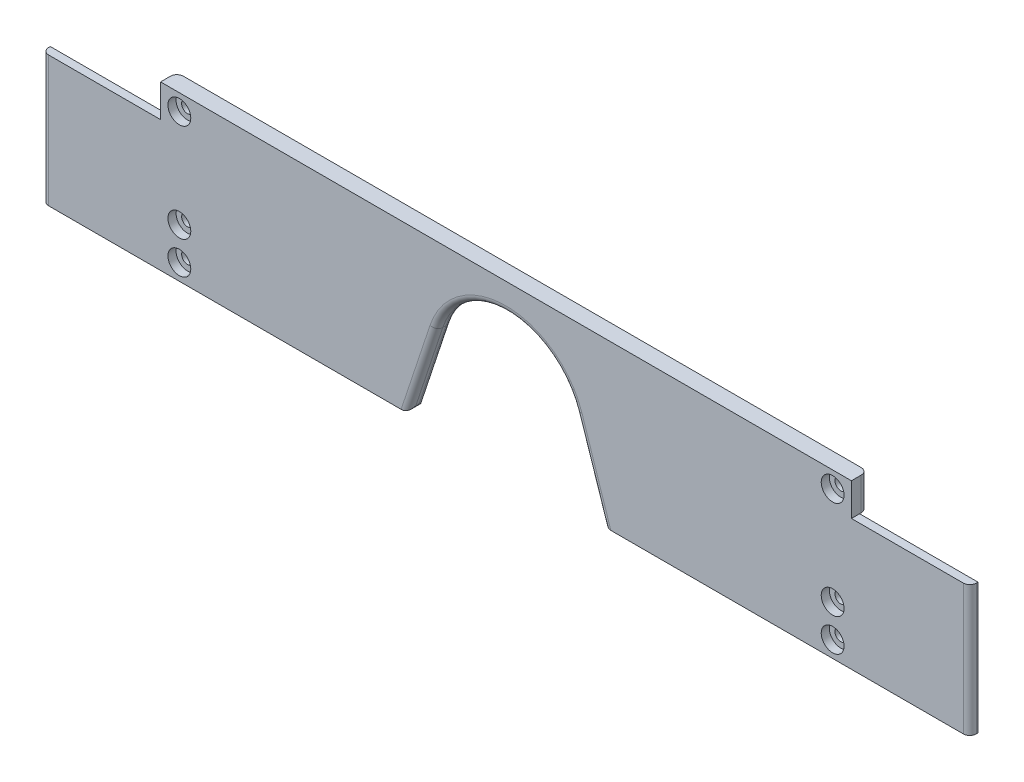
from build123d import *

# Parameters (mm, degrees)
SKETCH1_W           = 268.605
SKETCH1_H           = 63.5
SKETCH1_R           = 2.286
BOSS_EXTRUDE1_DEPTH = 3.175
SKETCH2_W           = 360.68
SKETCH2_H           = 63.5
SKETCH2_R           = 4.445
BOSS_EXTRUDE2_DEPTH = 3.175
SKETCH3_W           = 12.7
SKETCH3_H           = 25.4
CUT_EXTRUDE1_DEPTH  = 3.175
FILLET1_R           = 2.54
CUT_EXTRUDE2_DEPTH  = 184.223635484
FILLET2_R           = 2.54
SKETCH6_W           = 46.0375
SKETCH6_H           = 12.7
CUT_EXTRUDE3_DEPTH  = 184.141089669


with BuildPart() as part:
    # Sketch1 → Boss-Extrude1 (new body)
    with BuildSketch(Plane.XY):
        Rectangle(SKETCH1_W, SKETCH1_H)
        with Locations((-127, 25.4)):
            Circle(SKETCH1_R, mode=Mode.SUBTRACT)
        with Locations((-127, -12.7)):
            Circle(SKETCH1_R, mode=Mode.SUBTRACT)
        with Locations((-127, -25.4)):
            Circle(SKETCH1_R, mode=Mode.SUBTRACT)
        with Locations(Location((127, 25.4, 0), (0, 0, 180))):
            Circle(SKETCH1_R, mode=Mode.SUBTRACT)
        with Locations(Location((127, -12.7, 0), (0, 0, 180))):
            Circle(SKETCH1_R, mode=Mode.SUBTRACT)
        with Locations(Location((127, -25.4, 0), (0, 0, 180))):
            Circle(SKETCH1_R, mode=Mode.SUBTRACT)
    extrude(amount=BOSS_EXTRUDE1_DEPTH)

    # Sketch2 → Boss-Extrude2 (add)
    with BuildSketch(Plane.XY.offset(3.175)):
        Rectangle(SKETCH2_W, SKETCH2_H)
        with Locations((-127, 25.4)):
            Circle(SKETCH2_R, mode=Mode.SUBTRACT)
        with Locations((-127, -12.7)):
            Circle(SKETCH2_R, mode=Mode.SUBTRACT)
        with Locations((-127, -25.4)):
            Circle(SKETCH2_R, mode=Mode.SUBTRACT)
        with Locations(Location((127, 25.4, 0), (0, 0, 180))):
            Circle(SKETCH2_R, mode=Mode.SUBTRACT)
        with Locations(Location((127, -12.7, 0), (0, 0, 180))):
            Circle(SKETCH2_R, mode=Mode.SUBTRACT)
        with Locations(Location((127, -25.4, 0), (0, 0, 180))):
            Circle(SKETCH2_R, mode=Mode.SUBTRACT)
    extrude(amount=BOSS_EXTRUDE2_DEPTH)

    # Sketch3 → Cut-Extrude1 (cut)
    with BuildSketch(Plane(origin=(0, 0, 0), x_dir=(-1, 0, 0), z_dir=(0, 0, -1))):
        with Locations((-127.9525, 6.35)):
            Rectangle(SKETCH3_W, SKETCH3_H)
        with Locations((127.9525, 6.35)):
            Rectangle(SKETCH3_W, SKETCH3_H)
    extrude(amount=-CUT_EXTRUDE1_DEPTH, mode=Mode.SUBTRACT)

    # Fillet1
    fillet1_edges = [part.edges().sort_by_distance(p)[0] for p in [
        (180.34, 0, 6.35),
        (-180.34, 0, 6.35),
        (-134.3025, 25.4, 0),
        (134.3025, -19.05, 0),
        (134.3025, 25.4, 0),
        (121.6025, 19.05, 1.5875),
        (121.6025, -6.35, 1.5875),
        (-121.6025, 19.05, 1.5875),
        (-121.6025, -6.35, 1.5875),
    ]]
    fillet(fillet1_edges, radius=FILLET1_R)

    # Sketch5 → Cut-Extrude2 (cut, through all)
    with BuildSketch(Plane(origin=(0, 0, 0), x_dir=(-1, 0, 0), z_dir=(0, 0, -1))):
        with BuildLine():
            Line((-27.124304603, 1.369033584), (-38.1, -31.75))
            Line((-38.1, -31.75), (38.1, -31.75))
            Line((38.1, -31.75), (27.124304603, 1.369033584))
            ThreePointArc((27.124304603, 1.369033584), (0, 20.955), (-27.124304603, 1.369033584))
        make_face()
    extrude(amount=-CUT_EXTRUDE2_DEPTH, mode=Mode.SUBTRACT)

    # Fillet2
    fillet2_edges = [part.edges().sort_by_distance(p)[0] for p in [
        (0, 20.955, 6.35),
        (-32.612152302, -15.190483208, 6.35),
        (-38.1, -31.75, 3.175),
        (32.612152302, -15.190483208, 6.35),
        (38.1, -31.75, 3.175),
        (0, 20.955, 0),
        (32.612152302, -15.190483208, 0),
        (-32.612152302, -15.190483208, 0),
    ]]
    fillet(fillet2_edges, radius=FILLET2_R)

    # Sketch6 → Cut-Extrude3 (cut, through all)
    with BuildSketch(Plane(origin=(0, 0, 3.175), x_dir=(-1, 0, 0), z_dir=(0, 0, -1))):
        with Locations((-157.32125, 25.4)):
            Rectangle(SKETCH6_W, SKETCH6_H)
        with Locations((157.32125, 25.4)):
            Rectangle(SKETCH6_W, SKETCH6_H)
    extrude(amount=-CUT_EXTRUDE3_DEPTH, mode=Mode.SUBTRACT)


solid = part.part
